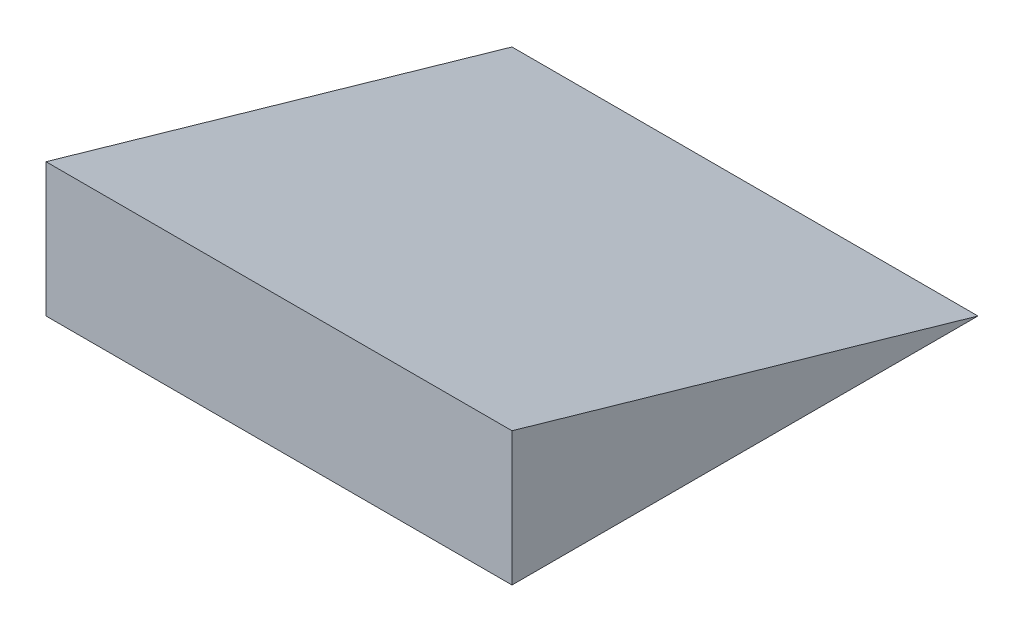
from build123d import *

# Parameters (mm, degrees)
BOSS_EXTRUDE1_DEPTH = 100


with BuildPart() as part:
    # Sketch2 → Boss-Extrude1 (new body)
    with BuildSketch(Plane(origin=(0, 0, 0), x_dir=(0, 0, -1), z_dir=(1, 0, 0))):
        Polygon((0, 0), (100, 0), (0, 28.674538576), align=None)
    extrude(amount=BOSS_EXTRUDE1_DEPTH)


solid = part.part
